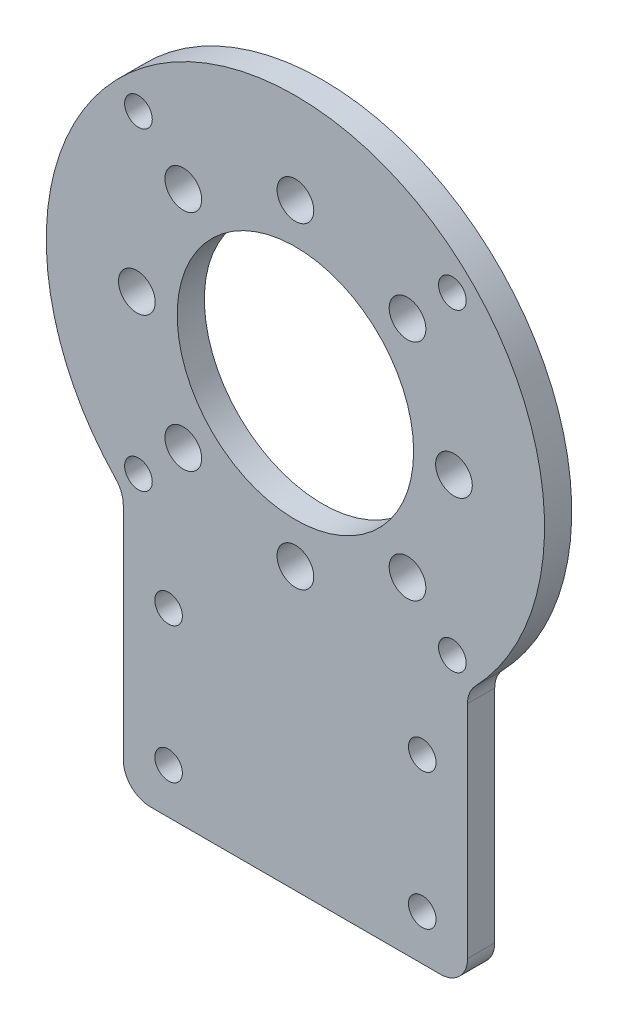
from build123d import *

# Parameters (mm, degrees)
SKETCH_1_R          = 27.5
SKETCH_1_R_2        = 13.05
EXTRUDE_1_DEPTH     = 1.5
SKETCH_2_R          = 2.025
CUT_EXTRUDE_1_DEPTH = 17
EXTRUDE_2_DEPTH     = 3
SKETCH_5_R          = 1.525
CUT_EXTRUDE_2_DEPTH = 3
FILLET_1_R          = 3
SKETCH_7_R          = 1.525
CUT_EXTRUDE_4_DEPTH = 5


with BuildPart() as part:
    # 草图1 → 凸台-拉伸1 (new, symmetric)
    with BuildSketch(Plane.XY):
        Circle(SKETCH_1_R)
        Circle(SKETCH_1_R_2, mode=Mode.SUBTRACT)
    extrude(amount=EXTRUDE_1_DEPTH, both=True)

    # 草图2 → 切除-拉伸1 (cut, symmetric)
    with BuildSketch(Plane.XY.offset(1.5)):
        with Locations((0, 17.5)):
            Circle(SKETCH_2_R)
        with Locations((12.374368671, 12.374368671)):
            Circle(SKETCH_2_R)
        with Locations((17.5, 0)):
            Circle(SKETCH_2_R)
        with Locations((12.374368671, -12.374368671)):
            Circle(SKETCH_2_R)
        with Locations((0, -17.5)):
            Circle(SKETCH_2_R)
        with Locations((-12.374368671, -12.374368671)):
            Circle(SKETCH_2_R)
        with Locations((-17.5, 0)):
            Circle(SKETCH_2_R)
        with Locations((-12.374368671, 12.374368671)):
            Circle(SKETCH_2_R)
    extrude(amount=CUT_EXTRUDE_1_DEPTH, both=True, mode=Mode.SUBTRACT)

    # 草图4 → 凸台-拉伸2 (add)
    with BuildSketch(Plane.XY.offset(1.5)):
        with BuildLine():
            Line((-19, -19.880895352), (-19, -48.5))
            Line((-19, -48.5), (19, -48.5))
            Line((19, -48.5), (19, -19.880895352))
            ThreePointArc((19, -19.880895352), (0, -27.5), (-19, -19.880895352))
        make_face()
    extrude(amount=-EXTRUDE_2_DEPTH)

    # 草图5 → 切除-拉伸2 (cut)
    with BuildSketch(Plane(origin=(0, 0, -1.5), x_dir=(-1, 0, 0), z_dir=(0, 0, -1))):
        with Locations((17.324116139, 17.324116139)):
            Circle(SKETCH_5_R)
        with Locations((17.324116139, -17.324116139)):
            Circle(SKETCH_5_R)
        with Locations((-17.324116139, -17.324116139)):
            Circle(SKETCH_5_R)
        with Locations((-17.324116139, 17.324116139)):
            Circle(SKETCH_5_R)
    extrude(amount=-CUT_EXTRUDE_2_DEPTH, mode=Mode.SUBTRACT)

    # 圆角1
    fillet_1_edges = [part.edges().sort_by_distance(p)[0] for p in [
        (-19, -19.880895352, 0),
        (19, -19.880895352, 0),
        (19, -48.5, 0),
        (-19, -48.5, 0),
    ]]
    fillet(fillet_1_edges, radius=FILLET_1_R)

    # 草图7 → 切除-拉伸4 (cut, symmetric)
    with BuildSketch(Plane(origin=(0, 0, -1.5), x_dir=(-1, 0, 0), z_dir=(0, 0, -1))):
        with Locations(Location((-14, -43.5, 0), (0, 0, 180))):
            Circle(SKETCH_7_R)
        with Locations(Location((-14, -28.5, 0), (0, 0, 180))):
            Circle(SKETCH_7_R)
        with Locations(Location((14, -43.5, 0), (0, 0, 180))):
            Circle(SKETCH_7_R)
        with Locations(Location((14, -28.5, 0), (0, 0, 180))):
            Circle(SKETCH_7_R)
    extrude(amount=CUT_EXTRUDE_4_DEPTH, both=True, mode=Mode.SUBTRACT)


solid = part.part
